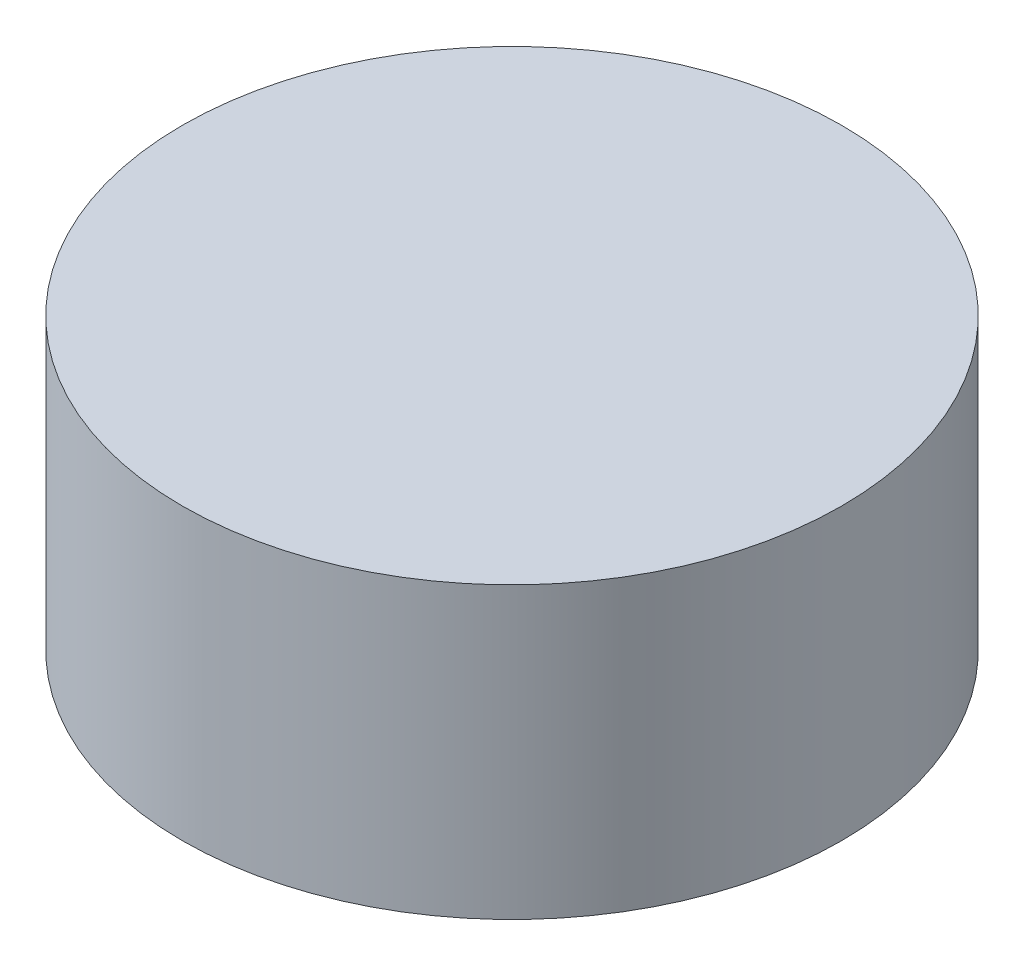
from build123d import *

# Parameters (mm, degrees)
SKETCH_1_R      = 2.275
EXTRUDE_1_DEPTH = 2


with BuildPart() as part:
    # 스케치1 → 보스-돌출1 (new body)
    with BuildSketch(Plane(origin=(0, 0, 0), x_dir=(1, 0, 0), z_dir=(0, 1, 0))):
        with Locations(Location((0, 0, 0), (0, 0, 270))):
            Circle(SKETCH_1_R)
    extrude(amount=EXTRUDE_1_DEPTH)


solid = part.part
